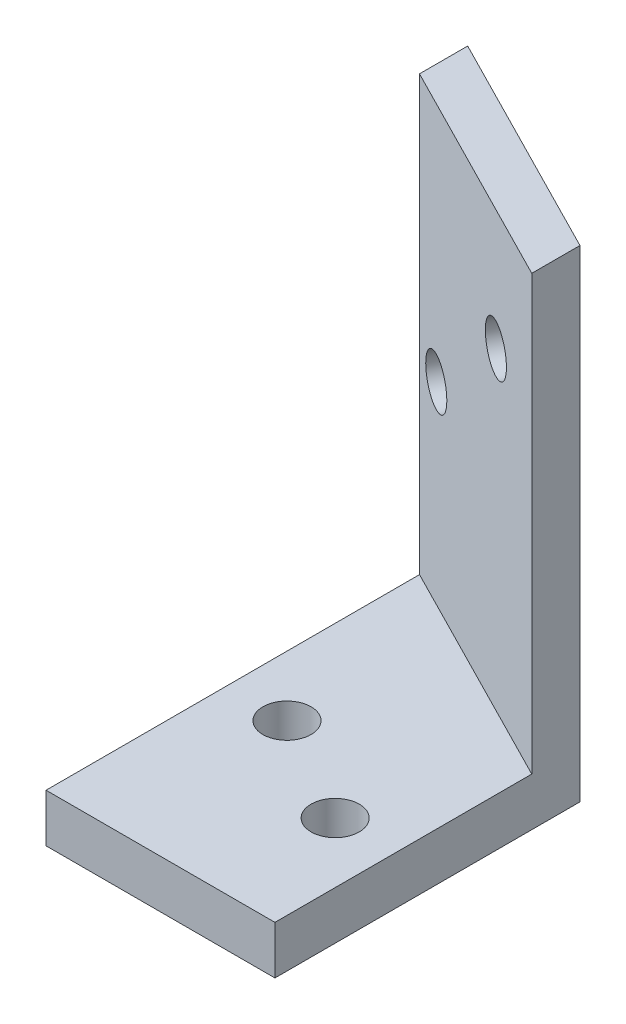
from build123d import *

# Parameters (mm, degrees)
SKETCH1_W           = 19
SKETCH1_H           = 35
BOSS_EXTRUDE1_DEPTH = 4
CUT_EXTRUDE1_DEPTH  = 4
BOSS_EXTRUDE2_DEPTH = 36
SKETCH4_R           = 2
CUT_EXTRUDE2_DEPTH  = 51.72266342
SKETCH5_R           = 2
CUT_EXTRUDE3_DEPTH  = 42.140004861


with BuildPart() as part:
    # Sketch1 → Boss-Extrude1 (new body)
    with BuildSketch(Plane(origin=(0, 0, 0), x_dir=(1, 0, 0), z_dir=(0, 1, 0))):
        Rectangle(SKETCH1_W, SKETCH1_H)
    extrude(amount=BOSS_EXTRUDE1_DEPTH)

    # Sketch2 → Cut-Extrude1 (cut)
    with BuildSketch(Plane(origin=(0, 4, 0), x_dir=(1, 0, 0), z_dir=(0, 1, 0))):
        Polygon((-9.5, 17.5), (9.5, 7.81901646), (9.5, 17.5), align=None)
    extrude(amount=-CUT_EXTRUDE1_DEPTH, mode=Mode.SUBTRACT)

    # Sketch3 → Boss-Extrude2 (add)
    with BuildSketch(Plane(origin=(0, 4, 0), x_dir=(1, 0, 0), z_dir=(0, 1, 0))):
        Polygon((-9.5, 17.5), (9.5, 7.81901646), (9.5, 3.81901646), (-9.5, 13.5), align=None)
    extrude(amount=BOSS_EXTRUDE2_DEPTH)

    # Sketch4 → Cut-Extrude2 (cut, through all)
    with BuildSketch(Plane(origin=(5.120878649, 0, -10.050290234), x_dir=(-0.8910065241883658, 0, -0.4539904997395508), z_dir=(0.4539904997395508, 0, -0.8910065241883658))):
        with Locations((0.08519721, 30)):
            Circle(SKETCH4_R)
        with Locations((11.409395725, 20)):
            Circle(SKETCH4_R)
    extrude(amount=-CUT_EXTRUDE2_DEPTH, mode=Mode.SUBTRACT)

    # Sketch5 → Cut-Extrude3 (cut, through all)
    with BuildSketch(Plane(origin=(0, 4, 0), x_dir=(1, 0, 0), z_dir=(0, 1, 0))):
        with Locations(Location((-4.5, -2.5, 0), (0, 0, 270))):
            Circle(SKETCH5_R)
        with Locations(Location((4.5, -7.5, 0), (0, 0, 270))):
            Circle(SKETCH5_R)
    extrude(amount=-CUT_EXTRUDE3_DEPTH, mode=Mode.SUBTRACT)


solid = part.part
